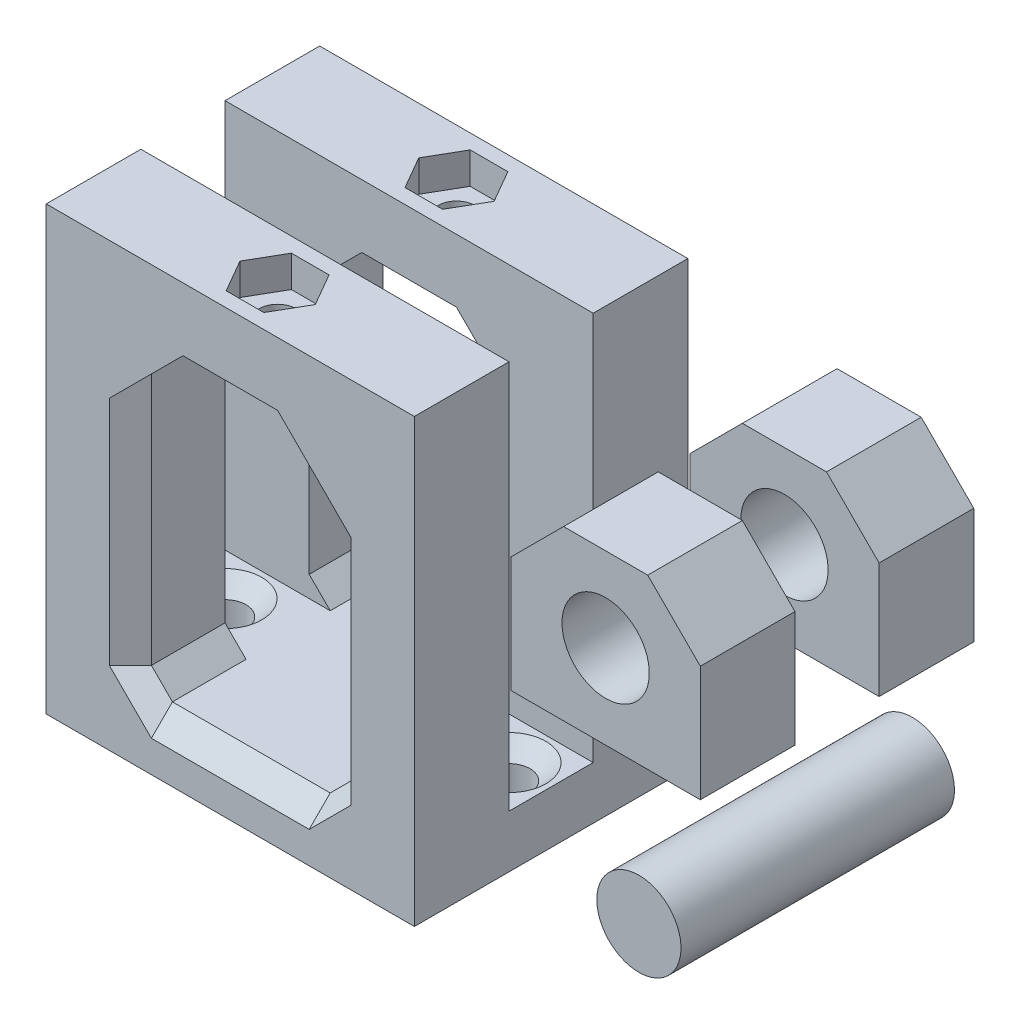
from build123d import *

# Parameters (mm, degrees)
SKETCH1_W               = 35
SKETCH1_H               = 9
SKETCH1_H_2             = 8
SKETCH1_R               = 2
SKETCH1_R_2             = 1.75
BOSS_EXTRUDE1_DEPTH     = 5
SKETCH1_3_W             = 35
SKETCH1_3_H             = 9
SKETCH1_3_R             = 1.75
BOSS_EXTRUDE2_DEPTH     = 42
CUT_EXTRUDE1_START      = 42
SKETCH1_4_R             = 1.75
CUT_EXTRUDE1_DEPTH      = 3
CUT_EXTRUDE2_START      = 42
SKETCH1_5_R             = 1.75
CUT_EXTRUDE2_DEPTH      = 37
CUT_EXTRUDE3_DEPTH      = 61.539243471
CUT_EXTRUDE3_DEPTH_BACK = 61.539243471
SKETCH2_W               = 19
SKETCH2_H               = 31
SKETCH2_R               = 4.15
CHAMFER1_SIZE           = 5
SKETCH3_R               = 4.15
BOSS_EXTRUDE3_DEPTH     = 9
CHAMFER2_SIZE           = 1.5
SKETCH4_R               = 4
BOSS_EXTRUDE4_DEPTH     = 26
CHAMFER3_SIZE           = 2


with BuildPart() as part:
    # Sketch1 → Boss-Extrude1 (new body)
    # profile 1 of 7: a face of its own
    with BuildSketch(Plane(origin=(0, 0, 0), x_dir=(1, 0, 0), z_dir=(0, 1, 0))):
        with Locations((17.5, 21.5)):
            Rectangle(SKETCH1_W, SKETCH1_H)
        Polygon((19.289785834, 18.4), (15.710214166, 18.4), (13.920428331, 21.5), (15.710214166, 24.6), (19.289785834, 24.6), (21.079571669, 21.5), align=None, mode=Mode.SUBTRACT)
    # profile 2 of 7: a face of its own
    with BuildSketch(Plane(origin=(0, 0, 0), x_dir=(1, 0, 0), z_dir=(0, 1, 0))):
        with Locations((17.5, 13)):
            Rectangle(SKETCH1_W, SKETCH1_H_2)
        with Locations(Location((4, 13, 0), (0, 0, 270))):
            Circle(SKETCH1_R, mode=Mode.SUBTRACT)
        with Locations(Location((31, 13, 0), (0, 0, 270))):
            Circle(SKETCH1_R, mode=Mode.SUBTRACT)
    # profile 3 of 7: a face of its own
    with BuildSketch(Plane(origin=(0, 0, 0), x_dir=(1, 0, 0), z_dir=(0, 1, 0))):
        with Locations((17.5, 4.5)):
            Rectangle(SKETCH1_W, SKETCH1_H)
        Polygon((19.289785834, 7.6), (21.079571669, 4.5), (19.289785834, 1.4), (15.710214166, 1.4), (13.920428331, 4.5), (15.710214166, 7.6), align=None, mode=Mode.SUBTRACT)
    # profile 4 of 7: a face of its own
    with BuildSketch(Plane(origin=(0, 0, 0), x_dir=(1, 0, 0), z_dir=(0, 1, 0))):
        Polygon((15.710214166, 24.6), (13.920428331, 21.5), (15.710214166, 18.4), (19.289785834, 18.4), (21.079571669, 21.5), (19.289785834, 24.6), align=None)
        with Locations((17.5, 21.5)):
            Circle(SKETCH1_R_2, mode=Mode.SUBTRACT)
    # profile 5 of 7: a face of its own
    with BuildSketch(Plane(origin=(0, 0, 0), x_dir=(1, 0, 0), z_dir=(0, 1, 0))):
        Polygon((19.289785834, 1.4), (15.710214166, 1.4), (13.920428331, 4.5), (15.710214166, 7.6), (19.289785834, 7.6), (21.079571669, 4.5), align=None)
        with Locations((17.5, 4.5)):
            Circle(SKETCH1_R_2, mode=Mode.SUBTRACT)
    # profile 6 of 7: a face of its own
    with BuildSketch(Plane(origin=(0, 0, 0), x_dir=(1, 0, 0), z_dir=(0, 1, 0))):
        with Locations((17.5, 4.5)):
            Circle(SKETCH1_R_2)
    # profile 7 of 7: a face of its own
    with BuildSketch(Plane(origin=(0, 0, 0), x_dir=(1, 0, 0), z_dir=(0, 1, 0))):
        with Locations((17.5, 21.5)):
            Circle(SKETCH1_R_2)
    extrude(amount=BOSS_EXTRUDE1_DEPTH)

    # Sketch1<3> → Boss-Extrude2 (add)
    # profile 1 of 6: a face of its own
    with BuildSketch(Plane(origin=(0, 0, 0), x_dir=(1, 0, 0), z_dir=(0, 1, 0))):
        with Locations((17.5, 21.5)):
            Rectangle(SKETCH1_3_W, SKETCH1_3_H)
        Polygon((19.289785834, 18.4), (15.710214166, 18.4), (13.920428331, 21.5), (15.710214166, 24.6), (19.289785834, 24.6), (21.079571669, 21.5), align=None, mode=Mode.SUBTRACT)
    # profile 2 of 6: a face of its own
    with BuildSketch(Plane(origin=(0, 0, 0), x_dir=(1, 0, 0), z_dir=(0, 1, 0))):
        with Locations((17.5, 4.5)):
            Rectangle(SKETCH1_3_W, SKETCH1_3_H)
        Polygon((19.289785834, 7.6), (21.079571669, 4.5), (19.289785834, 1.4), (15.710214166, 1.4), (13.920428331, 4.5), (15.710214166, 7.6), align=None, mode=Mode.SUBTRACT)
    # profile 3 of 6: a face of its own
    with BuildSketch(Plane(origin=(0, 0, 0), x_dir=(1, 0, 0), z_dir=(0, 1, 0))):
        Polygon((15.710214166, 24.6), (13.920428331, 21.5), (15.710214166, 18.4), (19.289785834, 18.4), (21.079571669, 21.5), (19.289785834, 24.6), align=None)
        with Locations((17.5, 21.5)):
            Circle(SKETCH1_3_R, mode=Mode.SUBTRACT)
    # profile 4 of 6: a face of its own
    with BuildSketch(Plane(origin=(0, 0, 0), x_dir=(1, 0, 0), z_dir=(0, 1, 0))):
        Polygon((19.289785834, 1.4), (15.710214166, 1.4), (13.920428331, 4.5), (15.710214166, 7.6), (19.289785834, 7.6), (21.079571669, 4.5), align=None)
        with Locations((17.5, 4.5)):
            Circle(SKETCH1_3_R, mode=Mode.SUBTRACT)
    # profile 5 of 6: a face of its own
    with BuildSketch(Plane(origin=(0, 0, 0), x_dir=(1, 0, 0), z_dir=(0, 1, 0))):
        with Locations((17.5, 4.5)):
            Circle(SKETCH1_3_R)
    # profile 6 of 6: a face of its own
    with BuildSketch(Plane(origin=(0, 0, 0), x_dir=(1, 0, 0), z_dir=(0, 1, 0))):
        with Locations((17.5, 21.5)):
            Circle(SKETCH1_3_R)
    extrude(amount=BOSS_EXTRUDE2_DEPTH)

    # Sketch1<4> → Cut-Extrude1 (cut)
    # profile 1 of 4: a face of its own
    with BuildSketch(Plane(origin=(0, 0, 0), x_dir=(1, 0, 0), z_dir=(0, 1, 0)).offset(CUT_EXTRUDE1_START)):
        Polygon((15.710214166, 24.6), (13.920428331, 21.5), (15.710214166, 18.4), (19.289785834, 18.4), (21.079571669, 21.5), (19.289785834, 24.6), align=None)
        with Locations((17.5, 21.5)):
            Circle(SKETCH1_4_R, mode=Mode.SUBTRACT)
    # profile 2 of 4: a face of its own
    with BuildSketch(Plane(origin=(0, 0, 0), x_dir=(1, 0, 0), z_dir=(0, 1, 0)).offset(CUT_EXTRUDE1_START)):
        Polygon((19.289785834, 1.4), (15.710214166, 1.4), (13.920428331, 4.5), (15.710214166, 7.6), (19.289785834, 7.6), (21.079571669, 4.5), align=None)
        with Locations((17.5, 4.5)):
            Circle(SKETCH1_4_R, mode=Mode.SUBTRACT)
    # profile 3 of 4: a face of its own
    with BuildSketch(Plane(origin=(0, 0, 0), x_dir=(1, 0, 0), z_dir=(0, 1, 0)).offset(CUT_EXTRUDE1_START)):
        with Locations((17.5, 4.5)):
            Circle(SKETCH1_4_R)
    # profile 4 of 4: a face of its own
    with BuildSketch(Plane(origin=(0, 0, 0), x_dir=(1, 0, 0), z_dir=(0, 1, 0)).offset(CUT_EXTRUDE1_START)):
        with Locations((17.5, 21.5)):
            Circle(SKETCH1_4_R)
    extrude(amount=-CUT_EXTRUDE1_DEPTH, mode=Mode.SUBTRACT)

    # Sketch1<5> → Cut-Extrude2 (cut)
    with BuildSketch(Plane(origin=(0, 0, 0), x_dir=(1, 0, 0), z_dir=(0, 1, 0)).offset(CUT_EXTRUDE2_START)):
        with Locations(Location((17.5, 21.5, 0), (0, 0, 270))):
            Circle(SKETCH1_5_R)
        with Locations(Location((17.5, 4.5, 0), (0, 0, 270))):
            Circle(SKETCH1_5_R)
    extrude(amount=-CUT_EXTRUDE2_DEPTH, mode=Mode.SUBTRACT)

    # Sketch2 → Cut-Extrude3 (cut, two sides: drawn at the far end of the back side and taken through both)
    # profile 1 of 2: a face of its own
    with BuildSketch(Plane.XY.offset(-CUT_EXTRUDE3_DEPTH_BACK)):
        with Locations((17.5, 20.5)):
            Rectangle(SKETCH2_W, SKETCH2_H)
        with Locations((17.5, 28)):
            Circle(SKETCH2_R, mode=Mode.SUBTRACT)
    # profile 2 of 2: a face of its own
    with BuildSketch(Plane.XY.offset(-CUT_EXTRUDE3_DEPTH_BACK)):
        with Locations((17.5, 28)):
            Circle(SKETCH2_R)
    extrude(amount=CUT_EXTRUDE3_DEPTH + CUT_EXTRUDE3_DEPTH_BACK, mode=Mode.SUBTRACT)

    # Chamfer1
    chamfer1_edges = [part.edges().sort_by_distance(p)[0] for p in [
        (27, 36, -4.5),
        (27, 36, -21.5),
        (8, 36, -4.5),
        (8, 36, -21.5),
    ]]
    chamfer(chamfer1_edges, length=CHAMFER1_SIZE)

    # Chamfer2
    chamfer2_edges = [part.edges().sort_by_distance(p)[0] for p in [
        (4, 5, -15),
        (31, 5, -15),
    ]]
    chamfer(chamfer2_edges, length=CHAMFER2_SIZE)

    # Chamfer3
    chamfer3_edges = [part.edges().sort_by_distance(p)[0] for p in [
        (8, 5, -4.5),
        (8, 18, 0),
        (8, 5, -21.5),
        (27, 5, -4.5),
        (17.5, 5, 0),
        (27, 5, -21.5),
        (17.5, 5, -26),
        (27, 18, 0),
        (8, 18, -26),
        (27, 18, -26),
    ]]
    chamfer(chamfer3_edges, length=CHAMFER3_SIZE)


with BuildPart() as body_2:
    # Sketch3 → Boss-Extrude3 (new body)
    with BuildSketch(Plane(origin=(0, 0, -26), x_dir=(-1, 0, 0), z_dir=(0, 0, -1))):
        Polygon((-57.187304591, 40.028562954), (-62.187304591, 35.028562954), (-62.187304591, 24.028562954), (-44.187304591, 24.028562954), (-44.187304591, 35.028562954), (-49.187304591, 40.028562954), align=None)
        with Locations((-53.187304591, 32.028562954)):
            Circle(SKETCH3_R, mode=Mode.SUBTRACT)
    extrude(amount=-BOSS_EXTRUDE3_DEPTH)


with BuildPart() as body_3:
    # Mirror2: mirrored copy
    add(body_2.part.mirror(Plane(origin=(0, 0, -13), x_dir=(1, 0, 0), z_dir=(0, 0, -1))))


with BuildPart() as body_4:
    # Sketch4 → Boss-Extrude4 (new body)
    with BuildSketch(Plane(origin=(0, 0, -26), x_dir=(-1, 0, 0), z_dir=(0, 0, -1))):
        with Locations((-56.349896332, 10.901949066)):
            Circle(SKETCH4_R)
    extrude(amount=-BOSS_EXTRUDE4_DEPTH)


solid = Compound([part.part, body_2.part, body_3.part, body_4.part])
